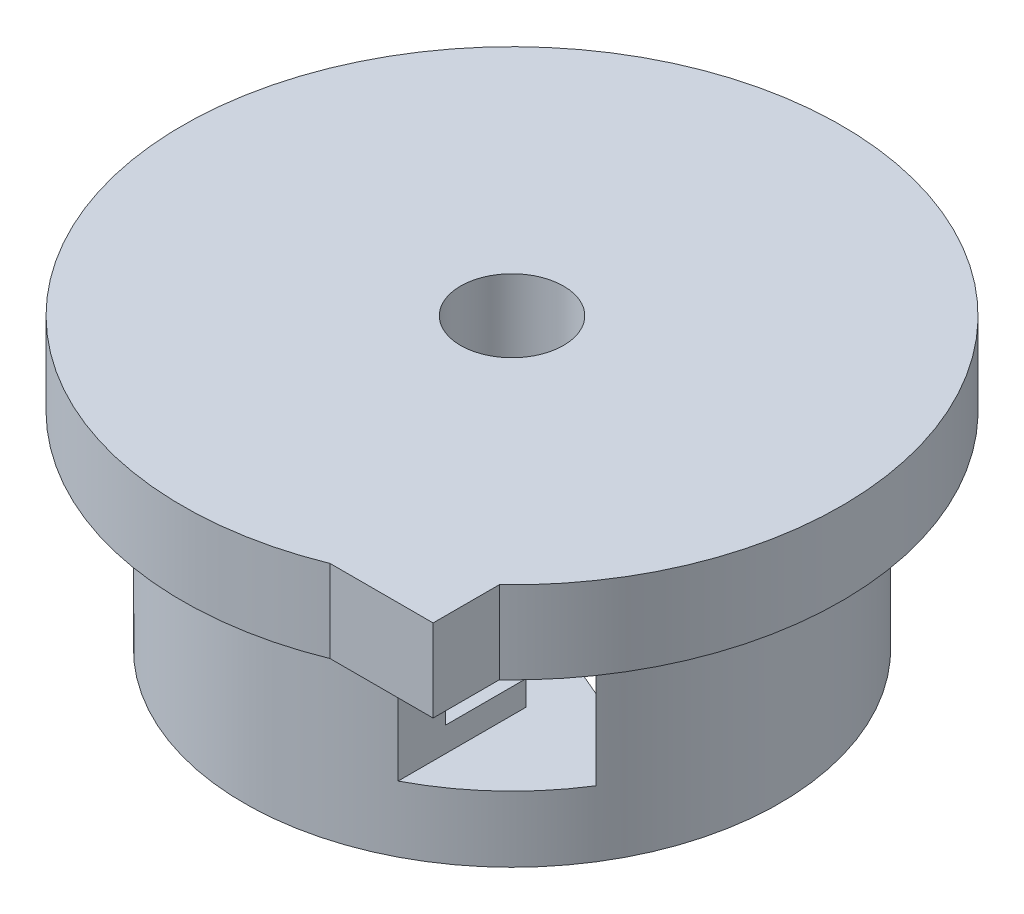
from build123d import *

# Parameters (mm, degrees)
SKETCH_1_R                   = 14.5
SKETCH_1_R_2                 = 12.5
EXTRUDE_1_DEPTH              = 40
SKETCH_2_R                   = 14.5
EXTRUDE_2_DEPTH              = 3
HOLE_WIZARD_M3_1_D           = 2.5
HOLE_WIZARD_M3_1_CSINK_D     = 3.05
HOLE_WIZARD_M3_1_CSINK_ANGLE = 100
CUT_EXTRUDE_1_DEPTH          = 45.949972191
CUT_EXTRUDE_1_DEPTH_BACK     = 45.949972191
SKETCH_5_R                   = 6.5
SWEEP_1_PROFILE_R            = 2
PATTERN_CIRCULAR_2_COUNT     = 3
SKETCH_63_R                  = 80
SKETCH_63_R_2                = 12.5
EXTRUDE_3_DEPTH              = 20
SWEEP_2_PROFILE_R            = 5
EXTRUDE_7_DEPTH              = 50
EXTRUDE_START                = -22
EXTRUDE_9_DEPTH              = 22
EXTRUDE_START_2              = -16
EXTRUDE_10_DEPTH             = 16
SKETCH_77_W                  = 28.912011908
SKETCH_77_H                  = 12.168261956
EXTRUDE_11_DEPTH             = 0.5
SWEEP_4_PROFILE_R            = 5
CUT_EXTRUDE_START            = -10
CUT_EXTRUDE_2_DEPTH          = 10
EXTRUDE_START_3              = -10
EXTRUDE_12_DEPTH             = 10
EXTRUDE_13_DEPTH             = 10


with BuildPart() as part:
    # 草图1 → 凸台-拉伸1 (new body)
    with BuildSketch(Plane(origin=(0, 0, 0), x_dir=(1, 0, 0), z_dir=(0, 1, 0))):
        with Locations(Location((0, 0, 0), (0, 0, 270))):
            Circle(SKETCH_1_R)
        with Locations(Location((0, 0, 0), (0, 0, 270))):
            Circle(SKETCH_1_R_2, mode=Mode.SUBTRACT)
    extrude(amount=EXTRUDE_1_DEPTH)

    # 草图2 → 凸台-拉伸2 (add)
    with BuildSketch(Plane.XZ):
        with Locations(Location((0, 0, 0), (0, 0, 90))):
            Circle(SKETCH_2_R)
    extrude(amount=-EXTRUDE_2_DEPTH)

    # M3 螺纹孔1 (through all)
    with Locations(Plane(origin=(-4.819576166, 0, 8.186677323), x_dir=(0, 0, -1), z_dir=(0, -1, 0))):
        with Locations((0, 0), (16.453891379, 0.139493715), (8.106140589, 14.319234783), (-41.683703384, 8.664072468)):
            CounterSinkHole(HOLE_WIZARD_M3_1_D / 2, HOLE_WIZARD_M3_1_CSINK_D / 2, counter_sink_angle=HOLE_WIZARD_M3_1_CSINK_ANGLE)

    # 草图5 → 切除-拉伸1 (cut, two sides: drawn at the far end of the back side and taken through both)
    with BuildSketch(Plane.XZ.offset(-CUT_EXTRUDE_1_DEPTH_BACK)):
        with Locations(Location((0, 0, 0), (0, 0, 270))):
            Circle(SKETCH_5_R)
    extrude(amount=CUT_EXTRUDE_1_DEPTH + CUT_EXTRUDE_1_DEPTH_BACK, mode=Mode.SUBTRACT)

    # 切除-扫描1: sweep along a path in 草图6
    with BuildLine(Plane.XZ) as sweep_1_path:
        ThreePointArc((-7.487297002, 7.361411794), (-10.49837053, -0.184976259), (-7.223321029, -7.620605836))
    # 切除-扫描1 profile (on start of the path) → 切除-扫描1 (sweep, cut)
    with BuildSketch(Plane(origin=(-7.487297002, 0, 7.361411794), x_dir=(-0.7130759049871914, 0, 0.7010868375078069), z_dir=(-0.7010868375078069, 0, -0.7130759049871914))):
        Circle(SWEEP_1_PROFILE_R)
    sweep_1 = sweep(path=sweep_1_path.line, mode=Mode.SUBTRACT)

    # 阵列(圆周)2: 切除-扫描1 ×3 about axis
    pattern_circular_2_axis = Axis((0, 0, 0), (0, 1, 0))
    for i in range(1, PATTERN_CIRCULAR_2_COUNT):
        add(sweep_1.rotate(pattern_circular_2_axis, i * 360 / PATTERN_CIRCULAR_2_COUNT), mode=Mode.SUBTRACT)

    # 草图63 → 凸台-拉伸3 (add)
    with BuildSketch(Plane(origin=(0, 40, 0), x_dir=(1, 0, 0), z_dir=(0, 1, 0))):
        with Locations(Location((0, 0, 0), (0, 0, 270))):
            Circle(SKETCH_63_R)
        with Locations(Location((0, 0, 0), (0, 0, 90))):
            Circle(SKETCH_63_R_2, mode=Mode.SUBTRACT)
    extrude(amount=EXTRUDE_3_DEPTH)

    # 切除-扫描2: sweep along a path in 草图64
    with BuildLine(Plane.XZ.offset(-40)) as sweep_2_path:
        CenterArc((0, 0), 35, 0, 360)
    # 切除-扫描2 profile (on start of the path) → 切除-扫描2 (sweep, cut)
    with BuildSketch(Plane(origin=(35, 40, 0), x_dir=(1, 0, 0), z_dir=(0, 0, 1))):
        Circle(SWEEP_2_PROFILE_R)
    sweep(path=sweep_2_path.line, mode=Mode.SUBTRACT)

    # 草图69 → 凸台-拉伸7 (add)
    with BuildSketch(Plane.XZ.offset(-40)):
        with BuildLine():
            Line((55, 0), (55, 34.641016151))
            ThreePointArc((55, 34.641016151), (-44.031247793, -47.814738499), (30, 57.662812973))
            Line((30, 57.662812973), (30, 46.097722286))
            ThreePointArc((30, 46.097722286), (-48.347699015, -26.220221204), (55, 0))
        make_face()
    extrude(amount=EXTRUDE_7_DEPTH)

    # 草图73 → 凸台-拉伸9 (add)
    with BuildSketch(Plane.XZ.offset(10).offset(EXTRUDE_START)):
        with BuildLine():
            Line((30, 46.097722286), (30, 57.662812973))
            ThreePointArc((30, 57.662812973), (24.396015634, 60.2481072), (18.572101117, 62.290264569))
            Line((18.572101117, 62.290264569), (20.407995727, 51.073610705))
            ThreePointArc((20.407995727, 51.073610705), (25.326495507, 48.821804814), (30, 46.097722286))
        make_face()
        with BuildLine():
            Line((30, 26.658525569), (30, 46.097722286))
            ThreePointArc((30, 46.097722286), (25.326495507, 48.821804814), (20.407995727, 51.073610705))
            Line((20.407995727, 51.073610705), (23.883285441, 29.840844074))
            Line((23.883285441, 29.840844074), (30, 26.658525569))
        make_face()
    extrude(amount=EXTRUDE_9_DEPTH)

    # 草图74 → 凸台-拉伸10 (add)
    with BuildSketch(Plane.XZ.offset(10).offset(EXTRUDE_START_2)):
        with BuildLine():
            Line((27.574976473, 11.816119182), (59.745782357, 25.601591562))
            ThreePointArc((59.745782357, 25.601591562), (45.400600541, 46.516507506), (24.14358885, 60.349706855))
            Line((24.14358885, 60.349706855), (11.143194854, 27.853710856))
            ThreePointArc((11.143194854, 27.853710856), (20.954123327, 21.46915731), (27.574976473, 11.816119182))
        make_face()
    extrude(amount=EXTRUDE_10_DEPTH)

    # 草图77 → 凸台-拉伸11 (add, symmetric)
    with BuildSketch(Plane(origin=(0, 0, 0), x_dir=(0, 0, -1), z_dir=(1, 0, 0))):
        with Locations((-49.290894705, 1.975614904)):
            Rectangle(SKETCH_77_W, SKETCH_77_H)
    extrude(amount=EXTRUDE_11_DEPTH, both=True)

    # 切除-扫描4: sweep along a path in 草图83
    with BuildLine(Plane(origin=(0, 20, 0), x_dir=(-1, 0, 0), z_dir=(0, -1, 0))) as sweep_4_path:
        Line((-55, -23.567982213), (-55, 0))
        ThreePointArc((-55, 0), (45.538114613, 30.842829272), (-20.407995727, -51.073610705))
    # 切除-扫描4 profile (on start of the path) → 切除-扫描4 (sweep, cut)
    with BuildSketch(Plane(origin=(55, 20, 23.567982213), x_dir=(-1, 0, 0), z_dir=(0, 0, -1))):
        Circle(SWEEP_4_PROFILE_R)
    sweep(path=sweep_4_path.line, mode=Mode.SUBTRACT)

    # 草图90 → 切除-拉伸2 (cut)
    with BuildSketch(Plane.XZ.offset(-40).offset(CUT_EXTRUDE_START)):
        with BuildLine():
            ThreePointArc((44.031247793, 47.814738499), (49.951814281, 41.591059736), (55, 34.641016151))
            Line((55, 34.641016151), (55, 58.094750193))
            ThreePointArc((55, 58.094750193), (43.252618505, 67.299413017), (30, 74.161984871))
            Line((30, 74.161984871), (30, 57.662812973))
            ThreePointArc((30, 57.662812973), (37.34169995, 53.203359338), (44.031247793, 47.814738499))
        make_face()
    extrude(amount=CUT_EXTRUDE_2_DEPTH, mode=Mode.SUBTRACT)

    # 草图91 → 凸台-拉伸12 (add)
    with BuildSketch(Plane.XZ.offset(-40).offset(EXTRUDE_START_3)):
        with BuildLine():
            Line((55, 58.094750193), (55, 74.161984871))
            Line((55, 74.161984871), (30, 74.161984871))
            ThreePointArc((30, 74.161984871), (43.252618505, 67.299413017), (55, 58.094750193))
        make_face()
    extrude(amount=-EXTRUDE_12_DEPTH)

    # 草图96 → 凸台-拉伸13 (add)
    with BuildSketch(Plane.XZ.offset(-50)):
        with BuildLine():
            Line((55, 34.641016151), (55, 58.094750193))
            Line((55, 58.094750193), (55, 74.161984871))
            Line((55, 74.161984871), (30, 74.161984871))
            Line((30, 74.161984871), (30, 57.662812973))
            ThreePointArc((30, 57.662812973), (44.031247793, 47.814738499), (55, 34.641016151))
        make_face()
    extrude(amount=EXTRUDE_13_DEPTH)


solid = part.part
